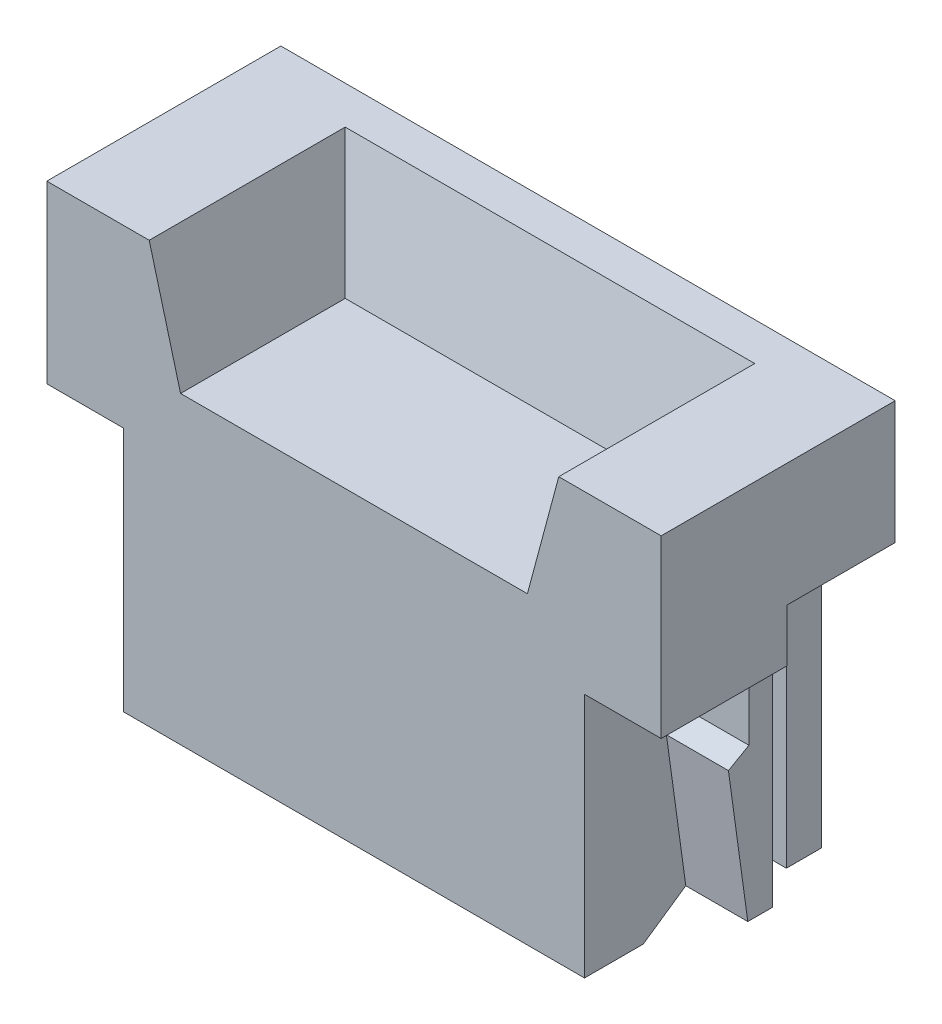
from build123d import *

# Parameters (mm, degrees)
BOSS_EXTRUDE1_DEPTH      = 5
CUT_EXTRUDE1_DEPTH       = 10.560857702
SKETCH3_W                = 0.9
SKETCH3_H                = 0.9
CUT_EXTRUDE2_DEPTH       = 10.195860993
BOSS_EXTRUDE2_DEPTH      = 1.06
BOSS_EXTRUDE2_DEPTH_BACK = 8.94
CUT_EXTRUDE3_DEPTH       = 5.399847063
BOSS_EXTRUDE3_DEPTH      = 0.1
BOSS_EXTRUDE3_DEPTH_BACK = 2
SKETCH6_W                = 10
SKETCH6_H                = 4
SKETCH7_W                = 7
SKETCH7_H                = 2
CUT_EXTRUDE4_DEPTH       = 2
CUT_EXTRUDE4_DRAFT       = -15
CUT_EXTRUDE5_REACH       = 11.635
SKETCH9_W                = 1.06
SKETCH9_H                = 1.75
BOSS_EXTRUDE4_DEPTH      = 0.9
BOSS_EXTRUDE5_DEPTH      = 0.25
BOSS_EXTRUDE6_START      = -10.25
BOSS_EXTRUDE6_DEPTH      = 0.25


with BuildPart() as part:
    # Sketch1 → Boss-Extrude1 (new, symmetric)
    with BuildSketch(Plane(origin=(0, 0, 0), x_dir=(0, 0, -1), z_dir=(1, 0, 0))):
        Polygon((4, 7.1), (1.092777193, 7.1), (1.092777193, 6.499060719), (0, 6.499060719), (0, 0), (1.004213348, 0), (1.730924726, 0.499707627), (3.45, 0.499707627), (3.45, 5.89955469), (4, 5.89955469), align=None)
    extrude(amount=BOSS_EXTRUDE1_DEPTH, both=True)

    # Sketch2 → Cut-Extrude1 (cut, through all)
    with BuildSketch(Plane(origin=(0, 7.1, 0), x_dir=(1, 0, 0), z_dir=(0, 1, 0))):
        Polygon((-6, 4), (-4.54, 4), (-4.54, 2.85), (-3.94, 2.85), (-3.94, 2.15), (-5, 2.15), (-5, 1.75), (-3.94, 1.75), (-3.94, 0), (-6, 0), align=None)
        Polygon((6, 0), (6, 4), (4.54, 4), (4.54, 2.85), (3.94, 2.85), (3.94, 2.15), (5, 2.15), (5, 1.75), (3.94, 1.75), (3.94, 0), align=None)
    extrude(amount=-CUT_EXTRUDE1_DEPTH, mode=Mode.SUBTRACT)

    # Sketch3 → Cut-Extrude2 (cut, through all)
    with BuildSketch(Plane.XZ.offset(-0.499707627)):
        with Locations((0, -2.35)):
            Rectangle(SKETCH3_W, SKETCH3_H)
        with Locations((2.5, -2.35)):
            Rectangle(SKETCH3_W, SKETCH3_H)
        with Locations((-2.5, -2.35)):
            Rectangle(SKETCH3_W, SKETCH3_H)
    extrude(amount=-CUT_EXTRUDE2_DEPTH, mode=Mode.SUBTRACT)

    # Sketch4 → Boss-Extrude2 (add, two sides: drawn at the far end of the back side and taken through both)
    with BuildSketch(Plane(origin=(3.94, 0, 0), x_dir=(0, 0, -1), z_dir=(1, 0, 0)).offset(-BOSS_EXTRUDE2_DEPTH_BACK)):
        Polygon((1.75, 0.499707627), (1.730924726, 0.499707627), (1.4, 2.899707627), (1.75, 3.099707627), align=None)
    extrude(amount=BOSS_EXTRUDE2_DEPTH + BOSS_EXTRUDE2_DEPTH_BACK)

    # Sketch5 → Cut-Extrude3 (cut)
    with BuildSketch(Plane.XZ.offset(-0.499707627)):
        Polygon((-1.55, -3.45), (-1.25, -3.15), (-0.95, -3.45), align=None)
        Polygon((0.95, -3.45), (1.55, -3.45), (1.25, -3.15), align=None)
    extrude(amount=-CUT_EXTRUDE3_DEPTH, mode=Mode.SUBTRACT)

    # Sketch6 → Boss-Extrude3 (add, two sides: drawn at the far end of the back side and taken through both)
    with BuildSketch(Plane(origin=(0, 7.1, 0), x_dir=(1, 0, 0), z_dir=(0, 1, 0)).offset(-BOSS_EXTRUDE3_DEPTH_BACK)):
        with Locations((0, 2)):
            Rectangle(SKETCH6_W, SKETCH6_H)
    extrude(amount=BOSS_EXTRUDE3_DEPTH + BOSS_EXTRUDE3_DEPTH_BACK)


with BuildPart() as cut_extrude4_tool:
    # Sketch7 → Cut-Extrude4 (with draft: the straight prism first)
    with BuildSketch(Plane(origin=(0, 7.2, 0), x_dir=(1, 0, 0), z_dir=(0, 1, 0))):
        with Locations((0, 2.35)):
            Rectangle(SKETCH7_W, SKETCH7_H)
    extrude(amount=-CUT_EXTRUDE4_DEPTH)
    # Cut-Extrude4: the draft: its side faces are tilted about the plane it starts from
    cut_extrude4_sides = [cut_extrude4_tool.faces().sort_by_distance(p)[0] for p in [
        (-3.5, 6.2, -2.35),
        (0, 6.2, -1.35),
        (3.5, 6.2, -2.35),
        (0, 6.2, -3.35),
    ]]
    draft(cut_extrude4_sides, Plane(origin=(0, 7.2, 0), x_dir=(1, 0, 0), z_dir=(0, 1, 0)), CUT_EXTRUDE4_DRAFT)


with BuildPart() as part_1:
    add(part.part)

    # Cut-Extrude4: cut by cut_extrude4_tool
    add(cut_extrude4_tool.part, mode=Mode.SUBTRACT)

    # Cut-Extrude5: up to this face of the body (flat: up to its plane)
    cut_extrude5_end = Plane(part_1.part.faces().sort_by_distance((0, 6.22763459, -1.610544526))[0])
    # Sketch8 → Cut-Extrude5 (cut, up to the picked face)
    with BuildSketch(Plane.XY, mode=Mode.PRIVATE) as cut_extrude5_sk1:
        Polygon((-3.5, 7.2), (-2.964101615, 5.2), (2.964101615, 5.2), (3.5, 7.2), align=None)
    cut_extrude5_tool1 = split(extrude(cut_extrude5_sk1.sketch, amount=-CUT_EXTRUDE5_REACH, mode=Mode.PRIVATE), bisect_by=cut_extrude5_end, keep=Keep.BOTH, mode=Mode.PRIVATE)
    add(cut_extrude5_tool1.solids().sort_by(Axis((0, 6.227635, 0), (0, 0, -1)))[0], mode=Mode.SUBTRACT)

    # Sketch9 → Boss-Extrude4 (add)
    with BuildSketch(Plane.XZ.offset(-5.1)):
        with Locations((-4.47, -0.875)):
            Rectangle(SKETCH9_W, SKETCH9_H)
        with Locations((4.47, -0.875)):
            Rectangle(SKETCH9_W, SKETCH9_H)
    extrude(amount=BOSS_EXTRUDE4_DEPTH)

    # Sketch10 → Boss-Extrude5 (add)
    with BuildSketch(Plane(origin=(5, 0, 0), x_dir=(0, 0, -1), z_dir=(1, 0, 0))):
        Polygon((0, 4.2), (2.15, 4.2), (2.15, 5.1), (4, 5.1), (4, 7.2), (0, 7.2), align=None)
    extrude(amount=BOSS_EXTRUDE5_DEPTH)

    # Sketch10<2> → Boss-Extrude6 (add)
    with BuildSketch(Plane(origin=(5, 0, 0), x_dir=(0, 0, -1), z_dir=(1, 0, 0)).offset(BOSS_EXTRUDE6_START)):
        Polygon((0, 4.2), (2.15, 4.2), (2.15, 5.1), (4, 5.1), (4, 7.2), (0, 7.2), align=None)
    extrude(amount=BOSS_EXTRUDE6_DEPTH)


solid = part_1.part
